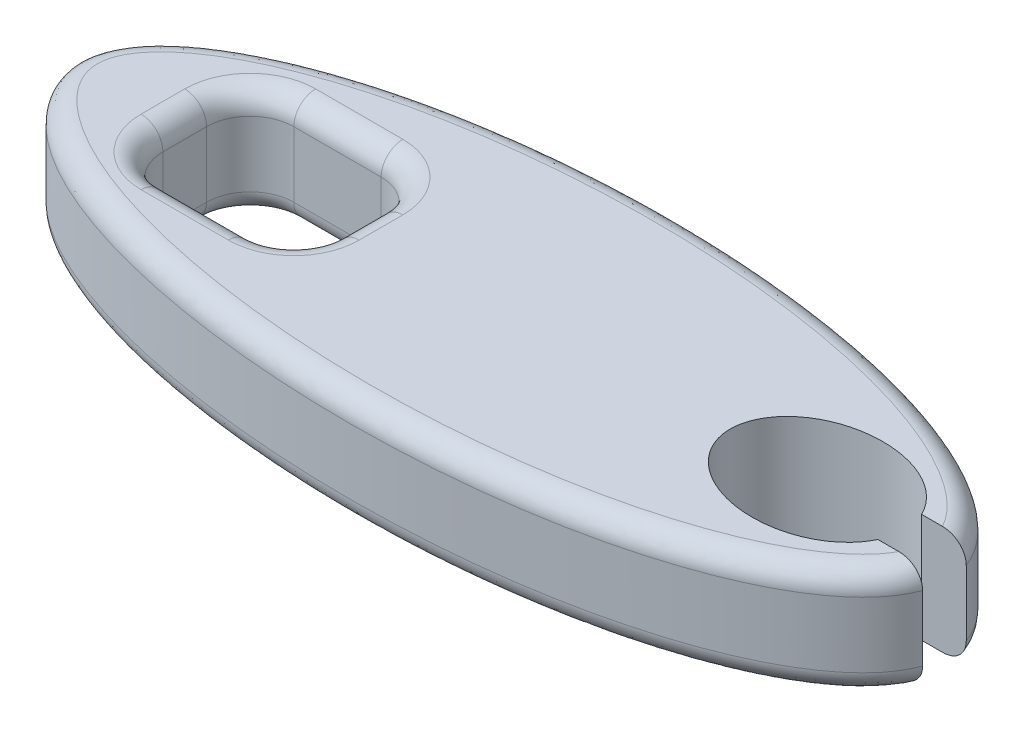
from build123d import *

# Parameters (mm, degrees)
SKETCH_1_W      = 8
SKETCH_1_H      = 6
EXTRUDE_1_DEPTH = 5
FILLET_1_R      = 2
FILLET_2_R      = 1


with BuildPart() as part:
    # 草图1 → 凸台-拉伸1 (new body)
    with BuildSketch(Plane(origin=(0, 0, 0), x_dir=(1, 0, 0), z_dir=(0, 1, 0))):
        with BuildLine():
            add(Edge.make_bspline(
                [(3.771236166, 1), (1.968708481, 4.823738649), (-2.37875275, 2.411869324), (-6.72621398, 0), (-2.37875275, -2.411869324), (1.968708481, -4.823738649), (3.771236166, -1)],
                knots=[0.339836909, 0.339836909, 0.339836909, 2.207674072, 2.207674072, 4.075511235, 4.075511235, 5.943348398, 5.943348398, 5.943348398], degree=2, weights=[1, 0.594688187, 1, 0.594688187, 1, 0.594688187, 1]))
            Line((3.771236166, 1), (5.821424996, 1))
            add(Edge.make_bspline(
                [(5.821424996, 1), (3.327360828, 7.95192426), (-15.336319586, 7.483239867), (-34, 7.014555473), (-34, 0)],
                knots=[3.275324243, 3.275324243, 3.275324243, 4.779254775, 4.779254775, 6.283185307, 6.283185307, 6.283185307], degree=2, weights=[1, 0.730347855, 1, 0.730347855, 1]))
            add(Edge.make_bspline(
                [(-34, 0), (-34, -7.014555473), (-15.336319586, -7.483239867), (3.327360828, -7.95192426), (5.821424996, -1)],
                knots=[0, 0, 0, 1.503930532, 1.503930532, 3.007861064, 3.007861064, 3.007861064], degree=2, weights=[1, 0.730347855, 1, 0.730347855, 1]))
            Line((5.821424996, -1), (3.771236166, -1))
        make_face()
        with Locations((-25, 0)):
            Rectangle(SKETCH_1_W, SKETCH_1_H, mode=Mode.SUBTRACT)
    extrude(amount=EXTRUDE_1_DEPTH)

    # 圆角1
    fillet_1_edges = [part.edges().sort_by_distance(p)[0] for p in [
        (-21, 2.5, 3),
        (-21, 2.5, -3),
        (-29, 2.5, -3),
        (-29, 2.5, 3),
    ]]
    fillet(fillet_1_edges, radius=FILLET_1_R)

    # 圆角2
    fillet_2_edges = [part.edges().sort_by_distance(p)[0] for p in [
        (-14.510444937, 0, 7.497556908),
        (-29, 0, 0),
        (-29, 5, 0),
        (-25, 0, 3),
        (-25, 5, 3),
        (-21, 0, 0),
        (-21, 5, 0),
        (-25, 0, -3),
        (-25, 5, -3),
        (-14.510444937, 5, 7.497556908),
        (-28.414213562, 0, 2.414213562),
        (-28.414213562, 5, 2.414213562),
        (-21.585786438, 0, 2.414213562),
        (-21.585786438, 5, 2.414213562),
        (-21.585786438, 0, -2.414213562),
        (-21.585786438, 5, -2.414213562),
        (-28.414213562, 0, -2.414213562),
        (-28.414213562, 5, -2.414213562),
    ]]
    fillet(fillet_2_edges, radius=FILLET_2_R)


solid = part.part
